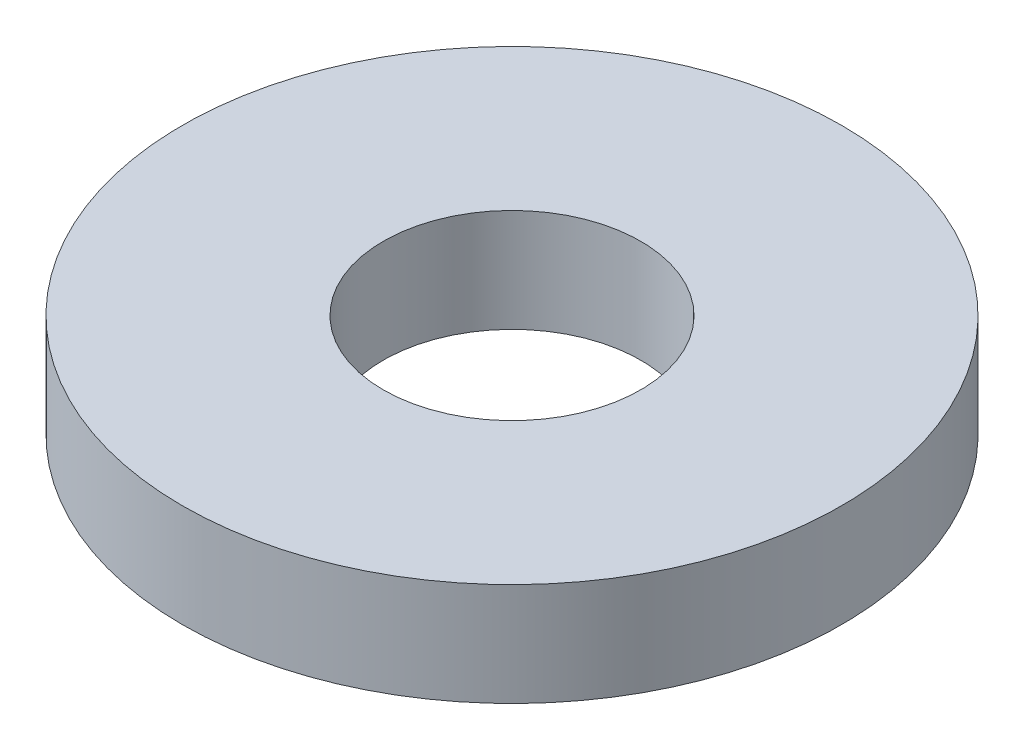
from build123d import *

# Parameters (mm, degrees)
SKETCH1_R           = 8.128
SKETCH1_R_2         = 3.175
BOSS_EXTRUDE1_DEPTH = 2.54


with BuildPart() as part:
    # Sketch1 → Boss-Extrude1 (new body)
    with BuildSketch(Plane(origin=(0, 0, 0), x_dir=(1, 0, 0), z_dir=(0, 1, 0))):
        with Locations(Location((0, 0, 0), (0, 0, 270))):
            Circle(SKETCH1_R)
        with Locations(Location((0, 0, 0), (0, 0, 270))):
            Circle(SKETCH1_R_2, mode=Mode.SUBTRACT)
    extrude(amount=BOSS_EXTRUDE1_DEPTH)


solid = part.part
